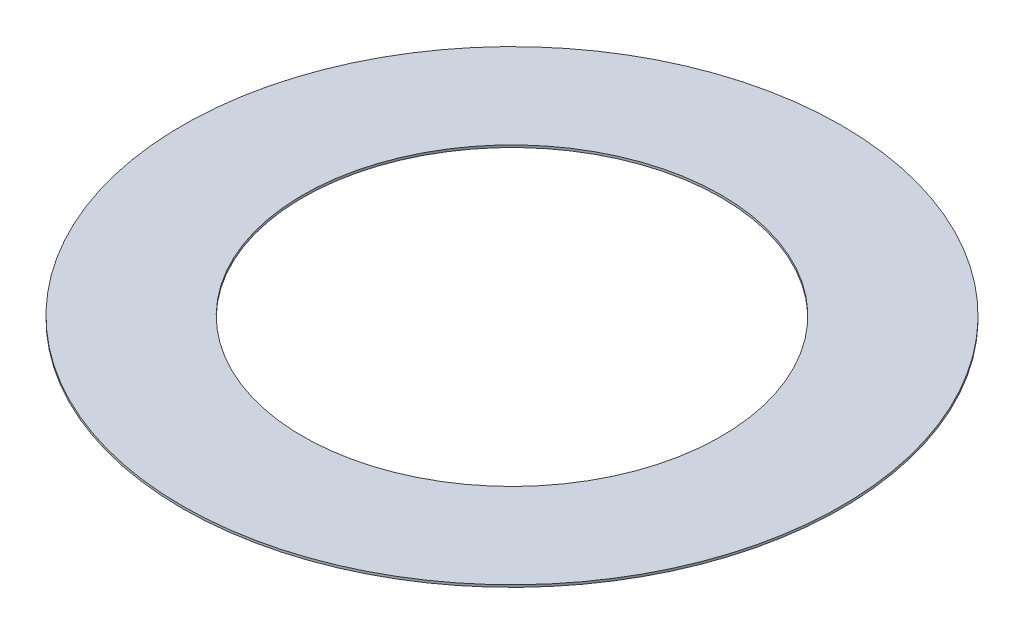
from build123d import *

# Parameters (mm, degrees)
SKETCH1_W = 40
SKETCH1_H = 0.76


with BuildPart() as part:
    # Sketch1 → Revolve1 (revolve)
    with BuildSketch(Plane.XY, mode=Mode.PRIVATE) as revolve1_sk:
        with Locations((-89.5, 7.7525)):
            Rectangle(SKETCH1_W, SKETCH1_H)
    revolve(revolve1_sk.sketch.rotate(Axis((0, -200069.047495165, 0), (0, 1, 0)), 270), axis=Axis((0, -200069.047495165, 0), (0, 1, 0)))


solid = part.part
